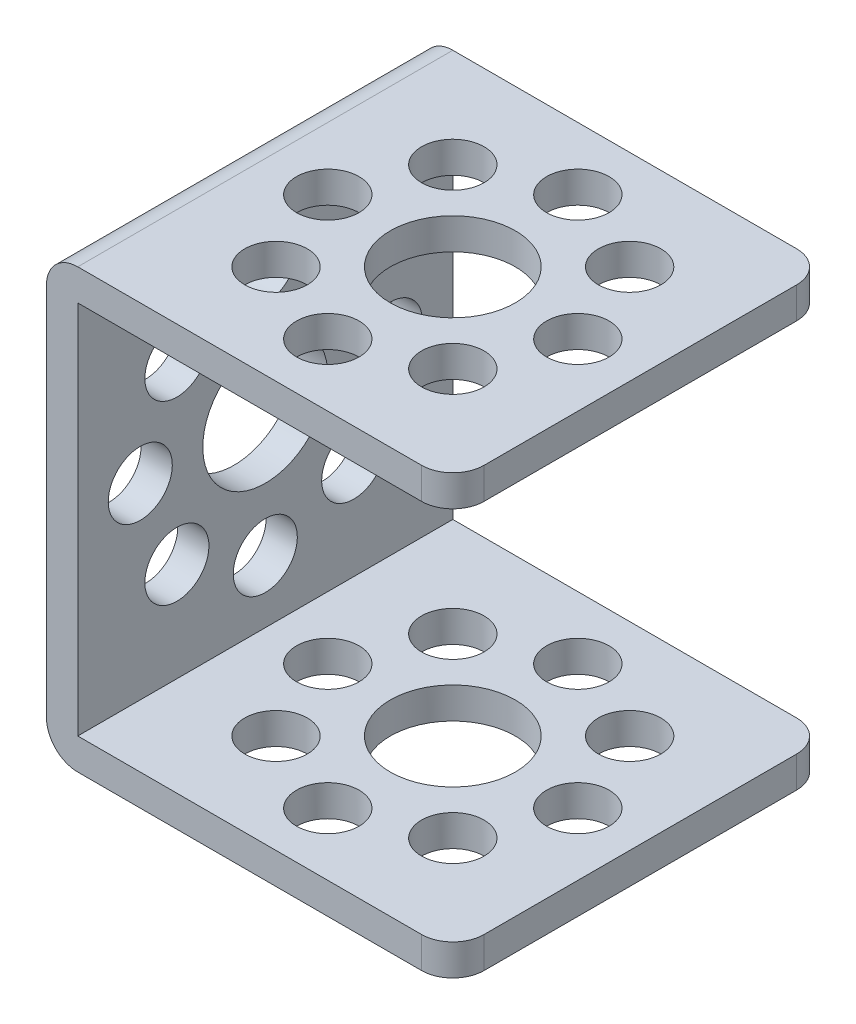
from build123d import *

# Parameters (mm, degrees)
BOSS_EXTRUDE1_DEPTH     = 24
SKETCH2_R               = 2.05
SKETCH2_R_2             = 4
CUT_EXTRUDE1_DEPTH      = 45
CUT_EXTRUDE2_DEPTH      = 44.9089968
CUT_EXTRUDE2_DEPTH_BACK = 44.9089968
SKETCH3_R               = 4
SKETCH3_R_2             = 2
FILLET1_R               = 2


with BuildPart() as part:
    # Sketch1 → Boss-Extrude1 (new body)
    with BuildSketch(Plane.XY):
        Polygon((0, 0), (0, 26), (0, 28), (26, 28), (26, 26), (2, 26), (2, 2), (26, 2), (26, 0), align=None)
    extrude(amount=BOSS_EXTRUDE1_DEPTH)

    # Sketch2 → Cut-Extrude1 (cut, through all)
    with BuildSketch(Plane(origin=(2, 0, 0), x_dir=(0, 0, -1), z_dir=(1, 0, 0))):
        with Locations(Location((-12, 22, 0), (0, 0, 90))):
            Circle(SKETCH2_R)
        with Locations(Location((-12, 14, 0), (0, 0, 90))):
            Circle(SKETCH2_R_2)
        with Locations(Location((-6.343145751, 19.656854249, 0), (0, 0, 90))):
            Circle(SKETCH2_R)
        with Locations(Location((-4, 14, 0), (0, 0, 90))):
            Circle(SKETCH2_R)
        with Locations(Location((-6.343145751, 8.343145751, 0), (0, 0, 90))):
            Circle(SKETCH2_R)
        with Locations(Location((-12, 6, 0), (0, 0, 90))):
            Circle(SKETCH2_R)
        with Locations(Location((-17.656854249, 8.343145751, 0), (0, 0, 90))):
            Circle(SKETCH2_R)
        with Locations(Location((-20, 14, 0), (0, 0, 90))):
            Circle(SKETCH2_R)
        with Locations(Location((-17.656854249, 19.656854249, 0), (0, 0, 90))):
            Circle(SKETCH2_R)
    extrude(amount=-CUT_EXTRUDE1_DEPTH, mode=Mode.SUBTRACT)

    # Sketch3 → Cut-Extrude2 (cut, two sides: drawn at the far end of the back side and taken through both)
    with BuildSketch(Plane(origin=(0, 2, 0), x_dir=(1, 0, 0), z_dir=(0, 1, 0)).offset(-CUT_EXTRUDE2_DEPTH_BACK)):
        with Locations(Location((14, -12, 0), (0, 0, 270))):
            Circle(SKETCH3_R)
        with Locations(Location((22, -12, 0), (0, 0, 270))):
            Circle(SKETCH3_R_2)
        with Locations(Location((19.656854249, -17.656854249, 0), (0, 0, 270))):
            Circle(SKETCH3_R_2)
        with Locations(Location((14, -20, 0), (0, 0, 270))):
            Circle(SKETCH3_R_2)
        with Locations(Location((8.343145751, -17.656854249, 0), (0, 0, 270))):
            Circle(SKETCH3_R_2)
        with Locations(Location((6, -12, 0), (0, 0, 270))):
            Circle(SKETCH3_R_2)
        with Locations(Location((8.343145751, -6.343145751, 0), (0, 0, 270))):
            Circle(SKETCH3_R_2)
        with Locations(Location((14, -4, 0), (0, 0, 270))):
            Circle(SKETCH3_R_2)
        with Locations(Location((19.656854249, -6.343145751, 0), (0, 0, 270))):
            Circle(SKETCH3_R_2)
    extrude(amount=CUT_EXTRUDE2_DEPTH + CUT_EXTRUDE2_DEPTH_BACK, mode=Mode.SUBTRACT)

    # Fillet1
    fillet1_edges = [part.edges().sort_by_distance(p)[0] for p in [
        (26, 1, 0),
        (0, 0, 12),
        (0, 28, 12),
        (26, 27, 24),
        (26, 1, 24),
        (26, 27, 0),
    ]]
    fillet(fillet1_edges, radius=FILLET1_R)


solid = part.part
